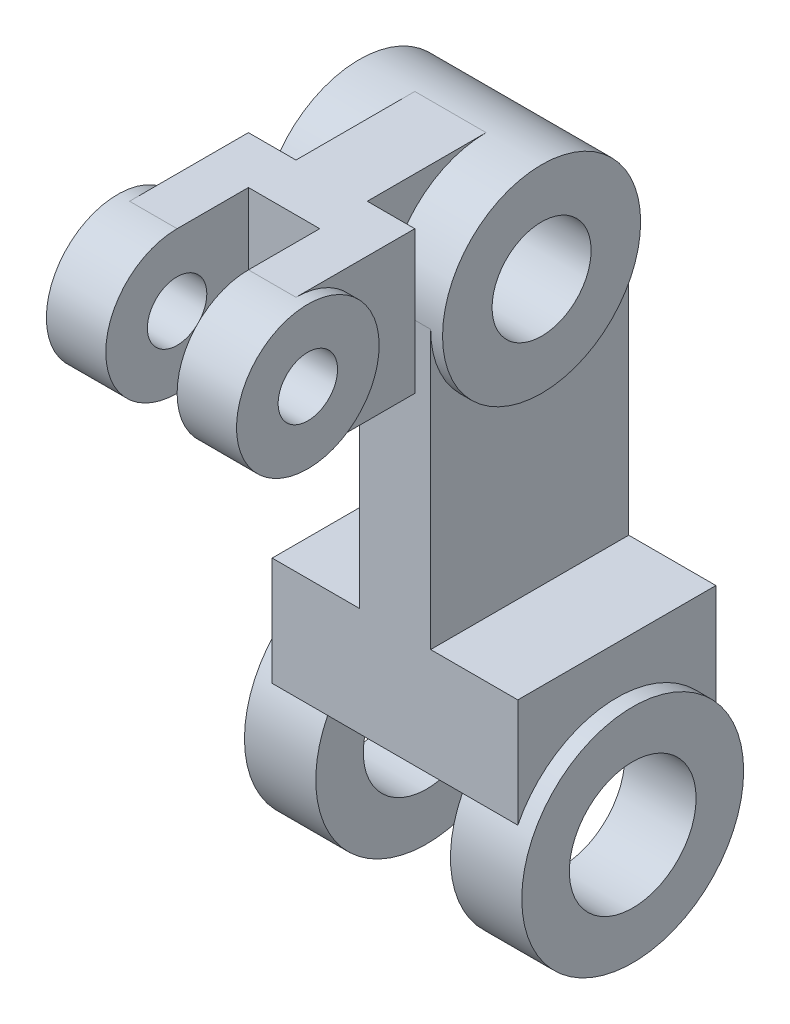
from build123d import *
from build123d.topology import SkipClean

# Parameters (mm, degrees)
BOSS_EXTRUDE1_DEPTH = 25
CUT_EXTRUDE1_DEPTH  = 148.978005832
CUT_EXTRUDE9_DEPTH  = 3
CUT_EXTRUDE10_START = -25
CUT_EXTRUDE10_DEPTH = 173.978005832
SKETCH6_3_R         = 12.5
CUT_EXTRUDE11_DEPTH = 148.978005832
BOSS_EXTRUDE2_START = 4
SKETCH7_R           = 28
SKETCH7_R_2         = 16
BOSS_EXTRUDE2_DEPTH = 18
LPATTERN1_COUNT     = 2
LPATTERN1_PITCH     = 52
BOSS_EXTRUDE3_DEPTH = 36
SKETCH9_R           = 12.5
CUT_EXTRUDE12_DEPTH = 168.010449404
CUT_EXTRUDE13_DEPTH = 168.426073866
CUT_EXTRUDE14_DEPTH = 3
LPATTERN2_COUNT     = 2
LPATTERN2_PITCH     = 45
SKETCH12_R          = 7.5
CUT_EXTRUDE15_DEPTH = 168.426073866


with BuildPart() as part:
    # Sketch2 → Boss-Extrude1 (new, symmetric)
    with BuildSketch(Plane.XY):
        Polygon((-1, -32.433962264), (31, -32.433962264), (31, 35.566037736), (9, 35.566037736), (9, 80.566037736), (12, 80.566037736), (12, 130.566037736), (0, 130.566037736), (-34, 130.566037736), (-34, 80.566037736), (-9, 80.566037736), (-9, 35.566037736), (-31, 35.566037736), (-31, -32.433962264), align=None)
    extrude(amount=BOSS_EXTRUDE1_DEPTH, both=True)

    # Sketch3 → Cut-Extrude1 (cut, through all)
    with BuildSketch(Plane(origin=(31, 0, 0), x_dir=(0, 0, -1), z_dir=(1, 0, 0))):
        with BuildLine():
            Line((-28, -4.433962264), (-30.641953589, -47.1115747))
            Line((-30.641953589, -47.1115747), (44.761332348, -47.1115747))
            Line((44.761332348, -47.1115747), (28, -4.433962264))
            ThreePointArc((28, -4.433962264), (0, 23.566037736), (-28, -4.433962264))
        make_face()
        with BuildLine():
            Line((-25, 105.566037736), (-43.623428006, 147.748377779))
            Line((-43.623428006, 147.748377779), (44.761332348, 142.473077281))
            Line((44.761332348, 142.473077281), (25, 105.566037736))
            ThreePointArc((25, 105.566037736), (0, 130.566037736), (-25, 105.566037736))
        make_face()
    extrude(amount=-CUT_EXTRUDE1_DEPTH, mode=Mode.SUBTRACT)

    # Sketch5 → Cut-Extrude9 (cut)
    with SkipClean():  # the faces are left unmerged after this step: merging them gives an invalid solid
        with BuildSketch(Plane(origin=(12, 0, 0), x_dir=(0, 0, -1), z_dir=(1, 0, 0))):
            with BuildLine():
                ThreePointArc((25, 105.566037736), (17.677669479, 87.888368155), (-1.45e-07, 80.566037736))
                Line((-1.45e-07, 80.566037736), (25, 80.566037736))
                Line((25, 80.566037736), (25, 105.566037736))
            make_face()
            with BuildLine():
                ThreePointArc((-1.45e-07, 80.566037736), (-17.677669581, 87.888368257), (-25, 105.566037736))
                Line((-25, 105.566037736), (-25, 80.566037736))
                Line((-25, 80.566037736), (-1.45e-07, 80.566037736))
            make_face()
        extrude(amount=-CUT_EXTRUDE9_DEPTH, mode=Mode.SUBTRACT)

    # Sketch6 → Cut-Extrude10 (cut, through all)
    with SkipClean():  # the faces are left unmerged after this step: merging them gives an invalid solid
        with BuildSketch(Plane.ZY.offset(34).offset(CUT_EXTRUDE10_START)):
            with BuildLine():
                Line((25, 80.566037736), (25, 105.566037736))
                ThreePointArc((25, 105.566037736), (17.6776695, 87.888368176), (-8.4e-08, 80.566037736))
                Line((-8.4e-08, 80.566037736), (25, 80.566037736))
            make_face()
            with BuildLine():
                ThreePointArc((-8.4e-08, 80.566037736), (-17.677669559, 87.888368236), (-25, 105.566037736))
                Line((-25, 105.566037736), (-25, 80.566037736))
                Line((-25, 80.566037736), (-8.4e-08, 80.566037736))
            make_face()
        extrude(amount=CUT_EXTRUDE10_DEPTH, mode=Mode.SUBTRACT)

    # Sketch6<3> → Cut-Extrude11 (cut, through all)
    with SkipClean():  # the faces are left unmerged after this step: merging them gives an invalid solid
        with BuildSketch(Plane.ZY.offset(34)):
            with Locations(Location((0, 105.566037736, 0), (0, 0, 270))):
                Circle(SKETCH6_3_R)
        extrude(amount=-CUT_EXTRUDE11_DEPTH, mode=Mode.SUBTRACT)

    # Sketch7 → Boss-Extrude2 (add)
    with SkipClean():  # the faces are left unmerged after this step: merging them gives an invalid solid
        with BuildSketch(Plane(origin=(31, 0, 0), x_dir=(0, 0, -1), z_dir=(1, 0, 0)).offset(BOSS_EXTRUDE2_START)):
            with Locations((0, -4.433962264)):
                Circle(SKETCH7_R)
            with Locations((0, -4.433962264)):
                Circle(SKETCH7_R_2, mode=Mode.SUBTRACT)
        boss_extrude2 = extrude(amount=-BOSS_EXTRUDE2_DEPTH)

    # LPattern1: Boss-Extrude2 ×2
    with SkipClean():  # the faces are left unmerged after this step: merging them gives an invalid solid
        with Locations(*[(-i * LPATTERN1_PITCH, 0, 0) for i in range(1, LPATTERN1_COUNT)]):
            add(boss_extrude2)

    # Sketch8 → Boss-Extrude3 (add)
    with SkipClean():  # the faces are left unmerged after this step: merging them gives an invalid solid
        with BuildSketch(Plane(origin=(0, 130.566037736, 0), x_dir=(1, 0, 0), z_dir=(0, 1, 0))):
            Polygon((-20, 0), (-2, 0), (-2, -30), (10, -30), (10, -42), (13, -42), (13, -78), (-2, -78), (-2, -42), (-20, -42), (-20, -78), (-35, -78), (-35, -42), (-32, -42), (-32, -30), (-20, -30), align=None)
        extrude(amount=-BOSS_EXTRUDE3_DEPTH)

    # Sketch9 → Cut-Extrude12 (cut, through all)
    with SkipClean():  # the faces are left unmerged after this step: merging them gives an invalid solid
        with BuildSketch(Plane.ZY.offset(34)):
            with Locations(Location((0, 105.566037736, 0), (0, 0, 270))):
                Circle(SKETCH9_R)
        extrude(amount=-CUT_EXTRUDE12_DEPTH, mode=Mode.SUBTRACT)

    # Sketch10 → Cut-Extrude13 (cut, through all)
    with SkipClean():  # the faces are left unmerged after this step: merging them gives an invalid solid
        with BuildSketch(Plane.ZY.offset(35)):
            with BuildLine():
                Line((60, 94.566037736), (99.579352657, 93.222301479))
                Line((99.579352657, 93.222301479), (99.579352657, 133.580048743))
                Line((99.579352657, 133.580048743), (60, 130.566037736))
                ThreePointArc((60, 130.566037736), (78, 112.566037736), (60, 94.566037736))
            make_face()
        extrude(amount=-CUT_EXTRUDE13_DEPTH, mode=Mode.SUBTRACT)

    # Sketch11 → Cut-Extrude14 (cut)
    with SkipClean():  # the faces are left unmerged after this step: merging them gives an invalid solid
        with BuildSketch(Plane.ZY.offset(35)):
            with BuildLine():
                Line((60, 130.566037736), (34.988350442, 136.05842118))
                Line((34.988350442, 136.05842118), (42, 90.490327212))
                Line((42, 90.490327212), (60, 94.566037736))
                ThreePointArc((60, 94.566037736), (42, 112.566037736), (60, 130.566037736))
            make_face()
        cut_extrude14 = extrude(amount=-CUT_EXTRUDE14_DEPTH, mode=Mode.SUBTRACT)

    # LPattern2: Cut-Extrude14 ×2
    with SkipClean():  # the faces are left unmerged after this step: merging them gives an invalid solid
        with Locations(*[(i * LPATTERN2_PITCH, 0, 0) for i in range(1, LPATTERN2_COUNT)]):
            add(cut_extrude14, mode=Mode.SUBTRACT)

    # Sketch12 → Cut-Extrude15 (cut, through all)
    with SkipClean():  # the faces are left unmerged after this step: merging them gives an invalid solid
        with BuildSketch(Plane.ZY.offset(35)):
            with Locations((60, 112.566037736)):
                Circle(SKETCH12_R)
        extrude(amount=-CUT_EXTRUDE15_DEPTH, mode=Mode.SUBTRACT)


solid = part.part
